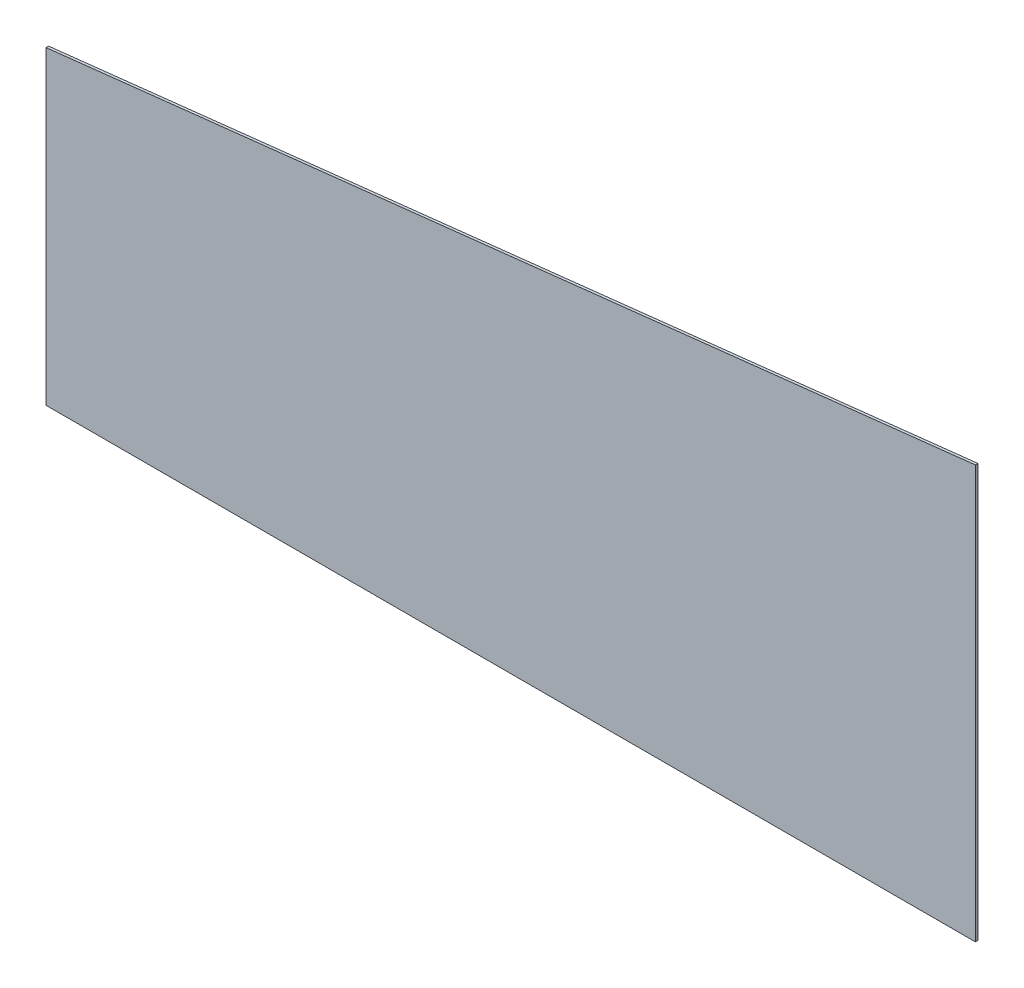
from build123d import *

# Parameters (mm, degrees)
BOSS_EXTRUDE2_DEPTH = 5


with BuildPart() as part:
    # Sketch1 → Boss-Extrude2 (new body)
    with BuildSketch(Plane.XY):
        Polygon((-900, 200), (900, 400), (900, -400), (-900, -400), align=None)
    extrude(amount=BOSS_EXTRUDE2_DEPTH)


solid = part.part
